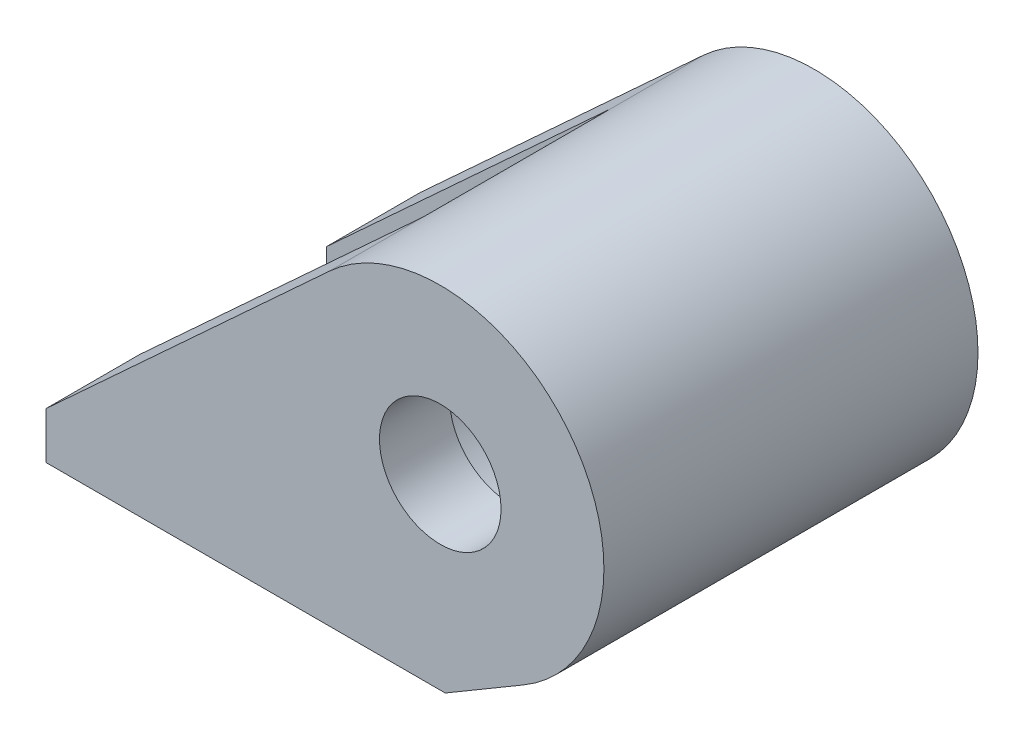
from build123d import *
from build123d.topology import SkipClean

# Parameters (mm, degrees)
EXTRUDE_1_DEPTH          = 80
SKETCH_2_R               = 13
CUT_EXTRUDE_2_DEPTH      = 15
CUT_EXTRUDE_START        = -15
SKETCH_4_R               = 13
CUT_EXTRUDE_3_DEPTH      = 15
CUT_EXTRUDE_4_DEPTH      = 123.918354375
CUT_EXTRUDE_4_DEPTH_BACK = 123.918354375
SKETCH_5_W               = 20
SKETCH_5_H               = 40
CUT_EXTRUDE_6_DEPTH      = 123.918354375
CUT_EXTRUDE_6_DEPTH_BACK = 24
CUT_EXTRUDE_7_DEPTH      = 131.345394404
CUT_EXTRUDE_8_DEPTH      = 32
CUT_EXTRUDE_8_DEPTH_BACK = 24
SKETCH_10_W              = 30
SKETCH_10_H              = 40
CUT_EXTRUDE_9_DEPTH      = 6
SKETCH_13_W              = 10.619852086
SKETCH_13_H              = 40
CUT_EXTRUDE_10_DEPTH     = 71
EXTRUDE_3_DEPTH          = 60
FILLET_1_R               = 3
SKETCH_14_R              = 25
CUT_EXTRUDE_11_DEPTH     = 50
CUT_EXTRUDE_START_2      = -95
SKETCH_16_R              = 13
CUT_EXTRUDE_12_DEPTH     = 95
SKETCH_17_W              = 10
SKETCH_17_H              = 50
EXTRUDE_4_DEPTH          = 16
SKETCH_20_W              = 10
SKETCH_20_H              = 50
EXTRUDE_5_DEPTH          = 20


with BuildPart() as part:
    # Эскиз1 → Бобышка-Вытянуть1 (new body)
    with BuildSketch(Plane.XY):
        with BuildLine():
            Line((-84.314422505, -30), (-23.694570419, 25.759800711))
            ThreePointArc((-23.694570419, 25.759800711), (28.113366731, 20.847988178), (17.769230769, -30.153846154))
            Line((17.769230769, -30.153846154), (1.060606061, -40))
            Line((1.060606061, -40), (-84.314422505, -40))
            Line((-84.314422505, -40), (-84.314422505, -30))
        make_face()
    extrude(amount=EXTRUDE_1_DEPTH)

    # Эскиз2 → Вырез-Вытянуть2 (cut)
    with BuildSketch(Plane.XY):
        Circle(SKETCH_2_R)
    extrude(amount=CUT_EXTRUDE_2_DEPTH, mode=Mode.SUBTRACT)

    # Эскиз4 → Вырез-Вытянуть3 (cut)
    with BuildSketch(Plane.XY.offset(80).offset(CUT_EXTRUDE_START)):
        Circle(SKETCH_4_R)
    extrude(amount=CUT_EXTRUDE_3_DEPTH, mode=Mode.SUBTRACT)

    # Эскиз5 → Вырез-Вытянуть4 (cut, two sides: drawn at the far end of the back side and taken through both)
    with BuildSketch(Plane(origin=(0, 0, 0), x_dir=(1, 0, 0), z_dir=(0, 1, 0)).offset(-CUT_EXTRUDE_4_DEPTH_BACK)):
        with Locations((-74.314422505, -40)):
            Rectangle(SKETCH_5_W, SKETCH_5_H)
    extrude(amount=CUT_EXTRUDE_4_DEPTH + CUT_EXTRUDE_4_DEPTH_BACK, mode=Mode.SUBTRACT)

    # Эскиз6 → Вырез-Вытянуть6 (cut, two sides: drawn at the far end of the back side and taken through both)
    with BuildSketch(Plane(origin=(0, 0, 0), x_dir=(1, 0, 0), z_dir=(0, 1, 0)).offset(-CUT_EXTRUDE_6_DEPTH_BACK)):
        with BuildLine():
            Line((-55, -25), (-84.314422505, -25))
            Line((-84.314422505, -25), (-84.314422505, -55))
            Line((-84.314422505, -55), (-55, -55))
            ThreePointArc((-55, -55), (-40, -40), (-55, -25))
        make_face()
    extrude(amount=CUT_EXTRUDE_6_DEPTH + CUT_EXTRUDE_6_DEPTH_BACK, mode=Mode.SUBTRACT)

    # Эскиз9 → Вырез-Вытянуть7 (cut, through all)
    with BuildSketch(Plane(origin=(0, -24, 0), x_dir=(1, 0, 0), z_dir=(0, 1, 0))):
        with BuildLine():
            Line((-55, -48), (-92.733432528, -48))
            Line((-92.733432528, -48), (-92.733432528, -32))
            Line((-92.733432528, -32), (-55, -32))
            ThreePointArc((-55, -32), (-47, -40), (-55, -48))
        make_face()
    extrude(amount=-CUT_EXTRUDE_7_DEPTH, mode=Mode.SUBTRACT)

    # Эскиз10 → Вырез-Вытянуть8 (cut, two sides: drawn at the far end of the back side and taken through both)
    with BuildSketch(Plane(origin=(0, 0, 0), x_dir=(1, 0, 0), z_dir=(0, 1, 0)).offset(-CUT_EXTRUDE_8_DEPTH_BACK)):
        with Locations((-49.314422505, -40)):
            Rectangle(SKETCH_10_W, SKETCH_10_H)
    extrude(amount=CUT_EXTRUDE_8_DEPTH + CUT_EXTRUDE_8_DEPTH_BACK, mode=Mode.SUBTRACT)

    # Эскиз11 → Вырез-Вытянуть9 (cut)
    with BuildSketch(Plane(origin=(0, -24, 0), x_dir=(1, 0, 0), z_dir=(0, 1, 0))):
        with BuildLine():
            Line((-55, -25), (-81.861005174, -25))
            Line((-81.861005174, -25), (-81.861005174, -55))
            Line((-81.861005174, -55), (-55, -55))
            ThreePointArc((-55, -55), (-40, -40), (-55, -25))
        make_face()
    extrude(amount=-CUT_EXTRUDE_9_DEPTH, mode=Mode.SUBTRACT)

    # Эскиз13 → Вырез-Вытянуть10 (cut)
    with BuildSketch(Plane(origin=(0, -24, 0), x_dir=(1, 0, 0), z_dir=(0, 1, 0))):
        with Locations((-29.004496462, -40)):
            Rectangle(SKETCH_13_W, SKETCH_13_H)
    extrude(amount=CUT_EXTRUDE_10_DEPTH, mode=Mode.SUBTRACT)

    # Эскиз12 → Бобышка-Вытянуть3 (add)
    with SkipClean():  # the faces are left unmerged after this step: merging them gives an invalid solid
        with BuildSketch(Plane.XY):
            with BuildLine():
                Line((-35, 0), (-35, -24))
                Line((-35, -24), (-25.475478406, -24))
                ThreePointArc((-25.475478406, -24), (32.53184397, 12.9104271), (-35, 0))
            make_face()
        extrude(amount=EXTRUDE_3_DEPTH)

    # Скругление1
    fillet_1_edges = [part.edges().sort_by_distance(p)[0] for p in [
        (-35, -24, 40),
    ]]
    fillet(fillet_1_edges, radius=FILLET_1_R)

    # Эскиз14 → Вырез-Вытянуть11 (cut)
    with SkipClean():  # the faces are left unmerged after this step: merging them gives an invalid solid
        with BuildSketch(Plane.XY.offset(65)):
            Circle(SKETCH_14_R)
        extrude(amount=-CUT_EXTRUDE_11_DEPTH, mode=Mode.SUBTRACT)

    # Эскиз16 → Вырез-Вытянуть12 (cut)
    with SkipClean():  # the faces are left unmerged after this step: merging them gives an invalid solid
        with BuildSketch(Plane.XY.offset(80).offset(CUT_EXTRUDE_START_2)):
            Circle(SKETCH_16_R)
        extrude(amount=CUT_EXTRUDE_12_DEPTH, mode=Mode.SUBTRACT)

    # Эскиз17 → Бобышка-Вытянуть4 (add)
    with SkipClean():  # the faces are left unmerged after this step: merging them gives an invalid solid
        with BuildSketch(Plane(origin=(0, 15, 0), x_dir=(1, 0, 0), z_dir=(0, 1, 0))):
            with Locations((0.685577495, -40)):
                Rectangle(SKETCH_17_W, SKETCH_17_H)
        extrude(amount=EXTRUDE_4_DEPTH)

    # Эскиз20 → Бобышка-Вытянуть5 (add)
    with SkipClean():  # the faces are left unmerged after this step: merging them gives an invalid solid
        with BuildSketch(Plane(origin=(0, -15, 0), x_dir=(1, 0, 0), z_dir=(0, 1, 0))):
            with Locations((0.685577495, -40)):
                Rectangle(SKETCH_20_W, SKETCH_20_H)
        extrude(amount=-EXTRUDE_5_DEPTH)


solid = part.part
